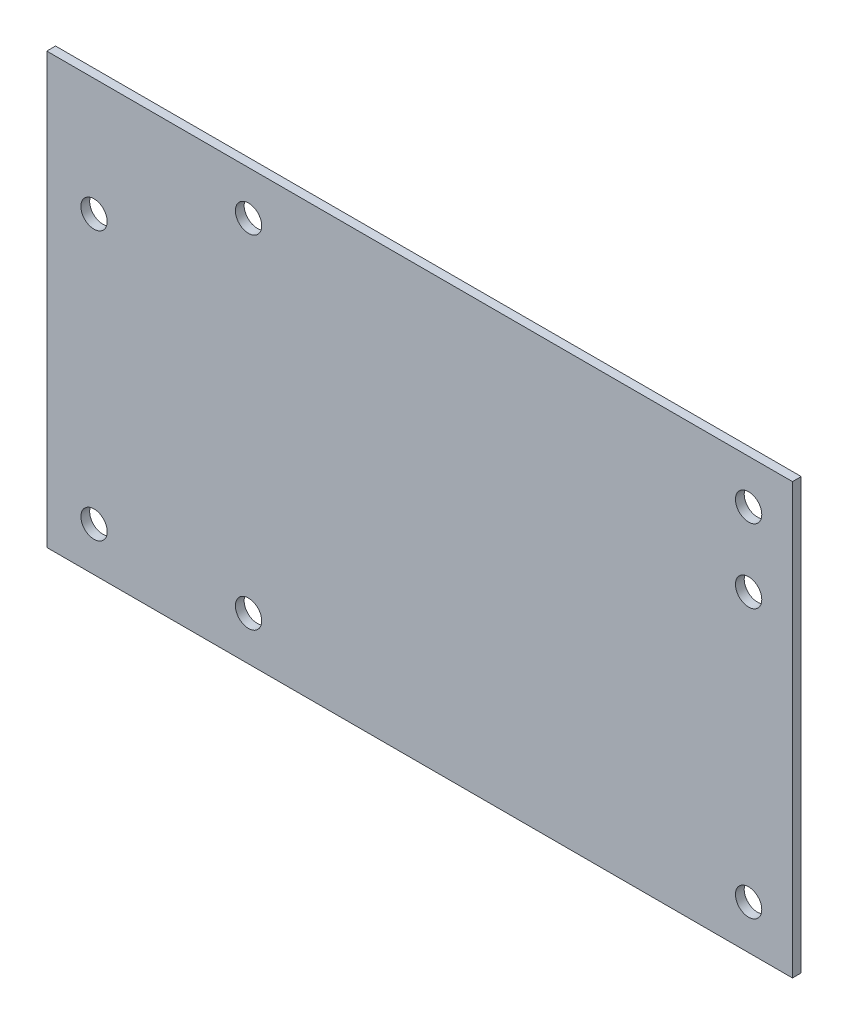
from build123d import *

# Parameters (mm, degrees)
SKETCH_1_W      = 85
SKETCH_1_H      = 49
SKETCH_1_R      = 1.5
EXTRUDE_1_DEPTH = 1


with BuildPart() as part:
    # Эскиз1 → Бобышка-Вытянуть1 (new body)
    with BuildSketch(Plane.XY):
        with Locations((-42.5, 24.5)):
            Rectangle(SKETCH_1_W, SKETCH_1_H)
        with Locations((-5, 5)):
            Circle(SKETCH_1_R, mode=Mode.SUBTRACT)
        with Locations((-5, 35.61)):
            Circle(SKETCH_1_R, mode=Mode.SUBTRACT)
        with Locations((-79.61, 35.61)):
            Circle(SKETCH_1_R, mode=Mode.SUBTRACT)
        with Locations((-79.61, 5)):
            Circle(SKETCH_1_R, mode=Mode.SUBTRACT)
        with Locations((-5, 44)):
            Circle(SKETCH_1_R, mode=Mode.SUBTRACT)
        with Locations((-62, 44)):
            Circle(SKETCH_1_R, mode=Mode.SUBTRACT)
        with Locations((-62, 5)):
            Circle(SKETCH_1_R, mode=Mode.SUBTRACT)
    extrude(amount=EXTRUDE_1_DEPTH)


solid = part.part
